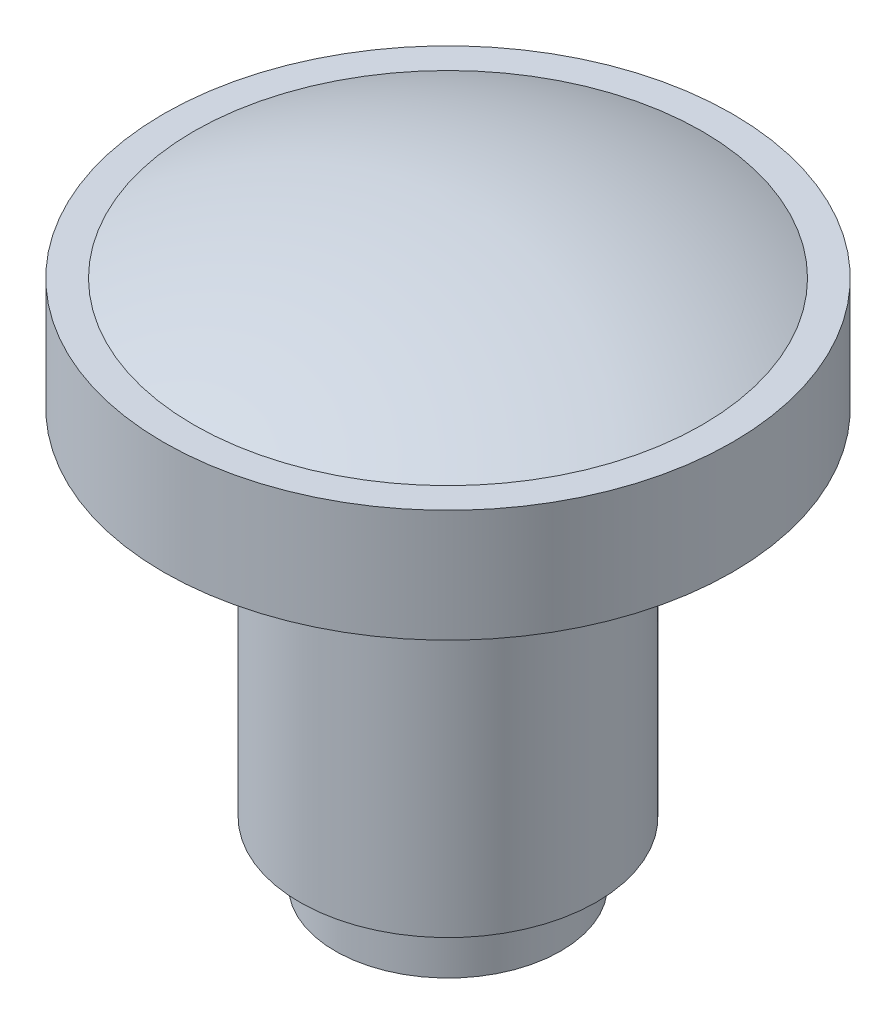
from build123d import *


with BuildPart() as part:
    # Esquisse1 → Révolution1 (revolve)
    with BuildSketch(Plane.XY):
        with BuildLine():
            Line((14.75, 0), (14.75, 30))
            Line((14.75, 30), (28.25, 35.128931493))
            Line((28.25, 35.128931493), (28.25, 46.3))
            Line((28.25, 46.3), (25.25, 46.3))
            ThreePointArc((25.25, 46.3), (12.953788056, 50.631361796), (0, 52.1))
            Line((0, 52.1), (0, 46.3))
            Line((0, 46.3), (0, -5.98683287))
            Line((0, -5.98683287), (11.203629045, -5.98683287))
            Line((11.203629045, -5.98683287), (11.203629045, 0))
            Line((11.203629045, 0), (14.75, 0))
        make_face()
    revolve(axis=Axis((0, 46.3, 0), (0, 1, 0)))


solid = part.part
